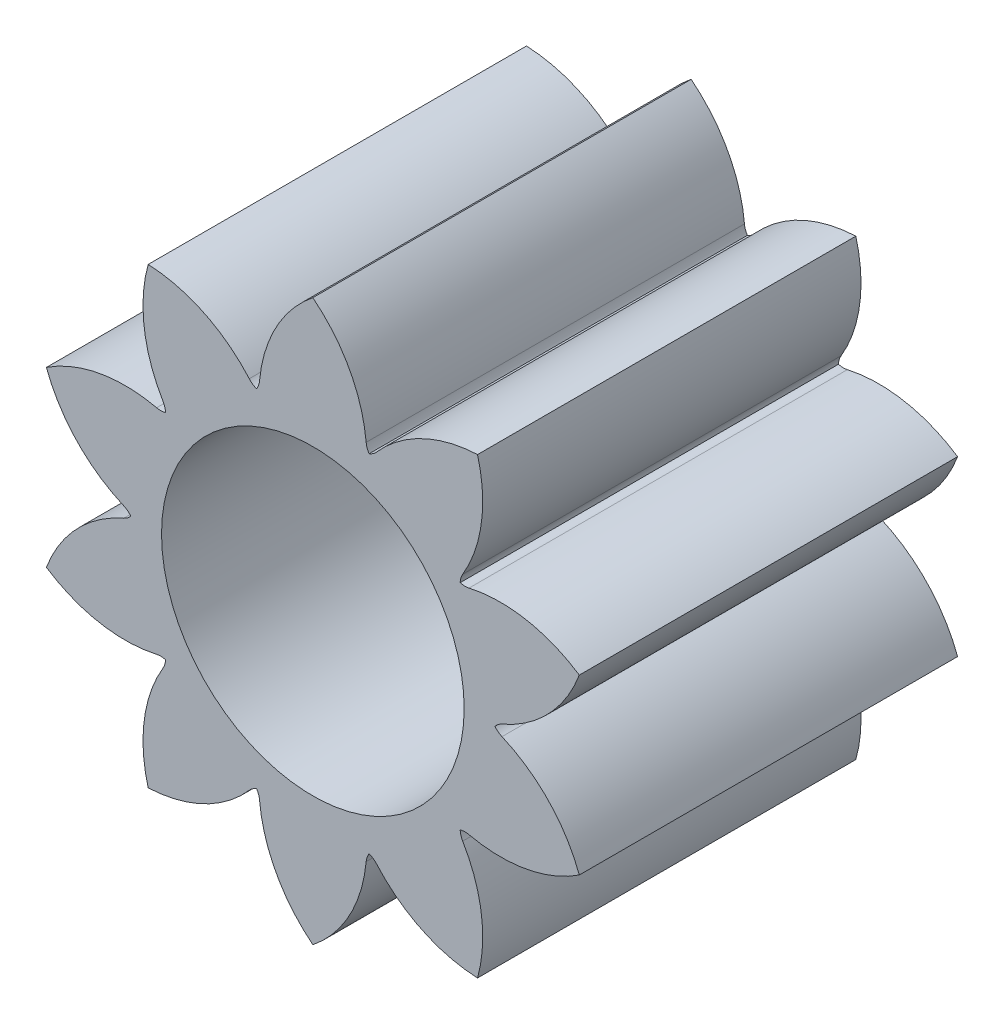
from build123d import *

# Parameters (mm, degrees)
BOSS_EXTRUDE1_DEPTH = 12.5
SKETCH2_R           = 10
CUT_EXTRUDE1_DEPTH  = 36.746855524


with BuildPart() as part:
    # Sketch1 → Boss-Extrude1 (new, symmetric)
    with BuildSketch(Plane.XY):
        with BuildLine():
            ThreePointArc((0, 18.51446423), (-2.427307325, 15.616232504), (-3.522517853, 11.9979343))
            ThreePointArc((-3.522517853, 11.9979343), (-3.586020803, 11.708984719), (-3.718536081, 11.444477279))
            ThreePointArc((-3.718536081, 11.444477279), (-3.981216766, 11.580577767), (-4.202432033, 11.777016791))
            ThreePointArc((-4.202432033, 11.777016791), (-7.215258285, 14.060532932), (-10.882529029, 14.978516204))
            ThreePointArc((-10.882529029, 14.978516204), (-11.142724039, 11.207062035), (-9.901985646, 7.636048701))
            ThreePointArc((-9.901985646, 7.636048701), (-9.783520309, 7.364957483), (-9.735253849, 7.073075942))
            ThreePointArc((-9.735253849, 7.073075942), (-10.027764846, 7.028783717), (-10.322195719, 7.057679154))
            ThreePointArc((-10.322195719, 7.057679154), (-14.101840469, 7.13418768), (-17.608301852, 5.721284089))
            ThreePointArc((-17.608301852, 5.721284089), (-15.601998897, 2.517174783), (-12.499231478, 0.357452038))
            ThreePointArc((-12.499231478, 0.357452038), (-12.244047587, 0.207766813), (-12.033435535, 0))
            ThreePointArc((-12.033435535, 0), (-12.244047587, -0.207766813), (-12.499231478, -0.357452038))
            ThreePointArc((-12.499231478, -0.357452038), (-15.601998897, -2.517174783), (-17.608301852, -5.721284089))
            ThreePointArc((-17.608301852, -5.721284089), (-14.101840469, -7.13418768), (-10.322195719, -7.057679154))
            ThreePointArc((-10.322195719, -7.057679154), (-10.027764846, -7.028783717), (-9.735253849, -7.073075942))
            ThreePointArc((-9.735253849, -7.073075942), (-9.783520309, -7.364957483), (-9.901985646, -7.636048701))
            ThreePointArc((-9.901985646, -7.636048701), (-11.142724039, -11.207062035), (-10.882529029, -14.978516204))
            ThreePointArc((-10.882529029, -14.978516204), (-7.215258285, -14.060532932), (-4.202432033, -11.777016791))
            ThreePointArc((-4.202432033, -11.777016791), (-3.981216766, -11.580577767), (-3.718536081, -11.444477279))
            ThreePointArc((-3.718536081, -11.444477279), (-3.586020803, -11.708984719), (-3.522517853, -11.9979343))
            ThreePointArc((-3.522517853, -11.9979343), (-2.427307325, -15.616232504), (0, -18.51446423))
            ThreePointArc((0, -18.51446423), (2.427307325, -15.616232504), (3.522517853, -11.9979343))
            ThreePointArc((3.522517853, -11.9979343), (3.586020803, -11.708984719), (3.718536081, -11.444477279))
            ThreePointArc((3.718536081, -11.444477279), (3.981216766, -11.580577767), (4.202432033, -11.777016791))
            ThreePointArc((4.202432033, -11.777016791), (7.215258285, -14.060532932), (10.882529029, -14.978516204))
            ThreePointArc((10.882529029, -14.978516204), (11.142724039, -11.207062035), (9.901985646, -7.636048701))
            ThreePointArc((9.901985646, -7.636048701), (9.783520309, -7.364957483), (9.735253849, -7.073075942))
            ThreePointArc((9.735253849, -7.073075942), (10.027764846, -7.028783717), (10.322195719, -7.057679154))
            ThreePointArc((10.322195719, -7.057679154), (14.101840469, -7.13418768), (17.608301852, -5.721284089))
            ThreePointArc((17.608301852, -5.721284089), (15.601998897, -2.517174783), (12.499231478, -0.357452038))
            ThreePointArc((12.499231478, -0.357452038), (12.244047587, -0.207766813), (12.033435535, 0))
            ThreePointArc((12.033435535, 0), (12.244047587, 0.207766813), (12.499231478, 0.357452038))
            ThreePointArc((12.499231478, 0.357452038), (15.601998897, 2.517174783), (17.608301852, 5.721284089))
            ThreePointArc((17.608301852, 5.721284089), (14.101840469, 7.13418768), (10.322195719, 7.057679154))
            ThreePointArc((10.322195719, 7.057679154), (10.027764846, 7.028783717), (9.735253849, 7.073075942))
            ThreePointArc((9.735253849, 7.073075942), (9.783520309, 7.364957483), (9.901985646, 7.636048701))
            ThreePointArc((9.901985646, 7.636048701), (11.142724039, 11.207062035), (10.882529029, 14.978516204))
            ThreePointArc((10.882529029, 14.978516204), (7.215258285, 14.060532932), (4.202432033, 11.777016791))
            ThreePointArc((4.202432033, 11.777016791), (3.981216766, 11.580577767), (3.718536081, 11.444477279))
            ThreePointArc((3.718536081, 11.444477279), (3.586020803, 11.708984719), (3.522517853, 11.9979343))
            ThreePointArc((3.522517853, 11.9979343), (2.427307325, 15.616232504), (0, 18.51446423))
        make_face()
    extrude(amount=BOSS_EXTRUDE1_DEPTH, both=True)

    # Sketch2 → Cut-Extrude1 (cut, through all)
    with BuildSketch(Plane.XY.offset(12.5)):
        Circle(SKETCH2_R)
    extrude(amount=-CUT_EXTRUDE1_DEPTH, mode=Mode.SUBTRACT)


solid = part.part
